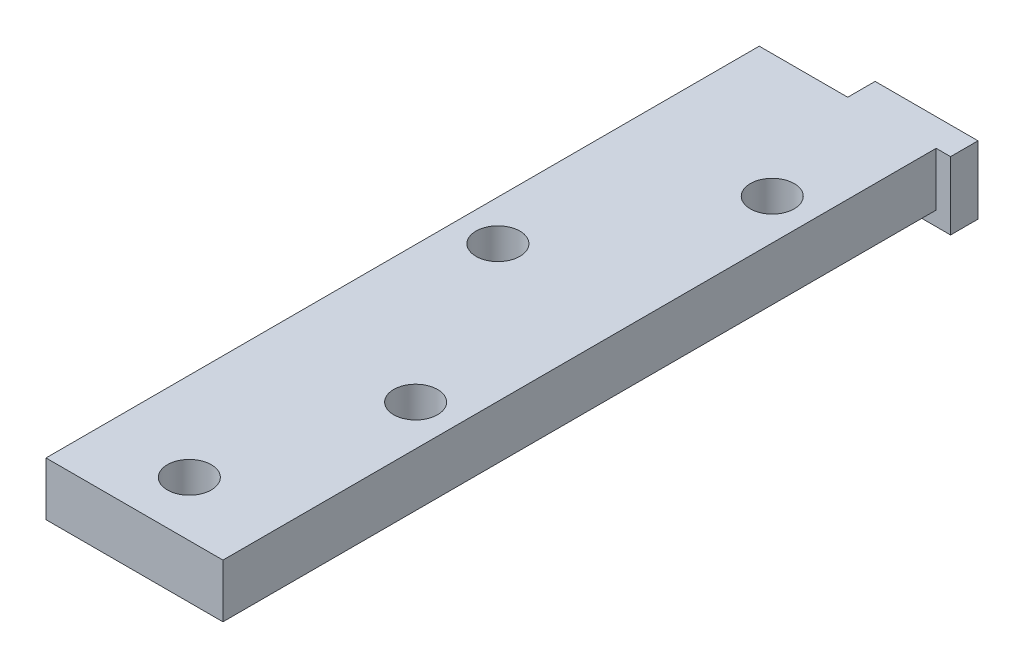
from build123d import *

# Parameters (mm, degrees)
SKETCH_1_W          = 7.5
SKETCH_1_H          = 6
EXTRUDE_1_DEPTH     = 2
SKETCH_2_W          = 12.9
SKETCH_2_H          = 3.9
EXTRUDE_2_DEPTH     = 52
SKETCH_3_R          = 1.6
CUT_EXTRUDE_1_DEPTH = 356
SKETCH_4_W          = 7.5
SKETCH_4_H          = 1.05
CUT_EXTRUDE_2_DEPTH = 10


with BuildPart() as part:
    # 草图1 → 凸台-拉伸1 (new body)
    with BuildSketch(Plane.XY):
        with Locations((3.75, 0)):
            Rectangle(SKETCH_1_W, SKETCH_1_H)
    extrude(amount=EXTRUDE_1_DEPTH)

    # 草图2 → 凸台-拉伸2 (add)
    with BuildSketch(Plane.XY.offset(2)):
        Rectangle(SKETCH_2_W, SKETCH_2_H)
    extrude(amount=EXTRUDE_2_DEPTH)

    # 草图3 → 切除-拉伸1 (cut)
    with BuildSketch(Plane.XZ.offset(1.95)):
        with Locations((3.5, 37)):
            Circle(SKETCH_3_R)
        with Locations((3.5, 11)):
            Circle(SKETCH_3_R)
        with Locations((-3.5, 24)):
            Circle(SKETCH_3_R)
        with Locations((0, 50)):
            Circle(SKETCH_3_R)
    extrude(amount=-CUT_EXTRUDE_1_DEPTH, mode=Mode.SUBTRACT)

    # 草图4 → 切除-拉伸2 (cut)
    with BuildSketch(Plane.XY.offset(2)):
        with Locations((3.75, 2.475)):
            Rectangle(SKETCH_4_W, SKETCH_4_H)
    extrude(amount=-CUT_EXTRUDE_2_DEPTH, mode=Mode.SUBTRACT)


solid = part.part
